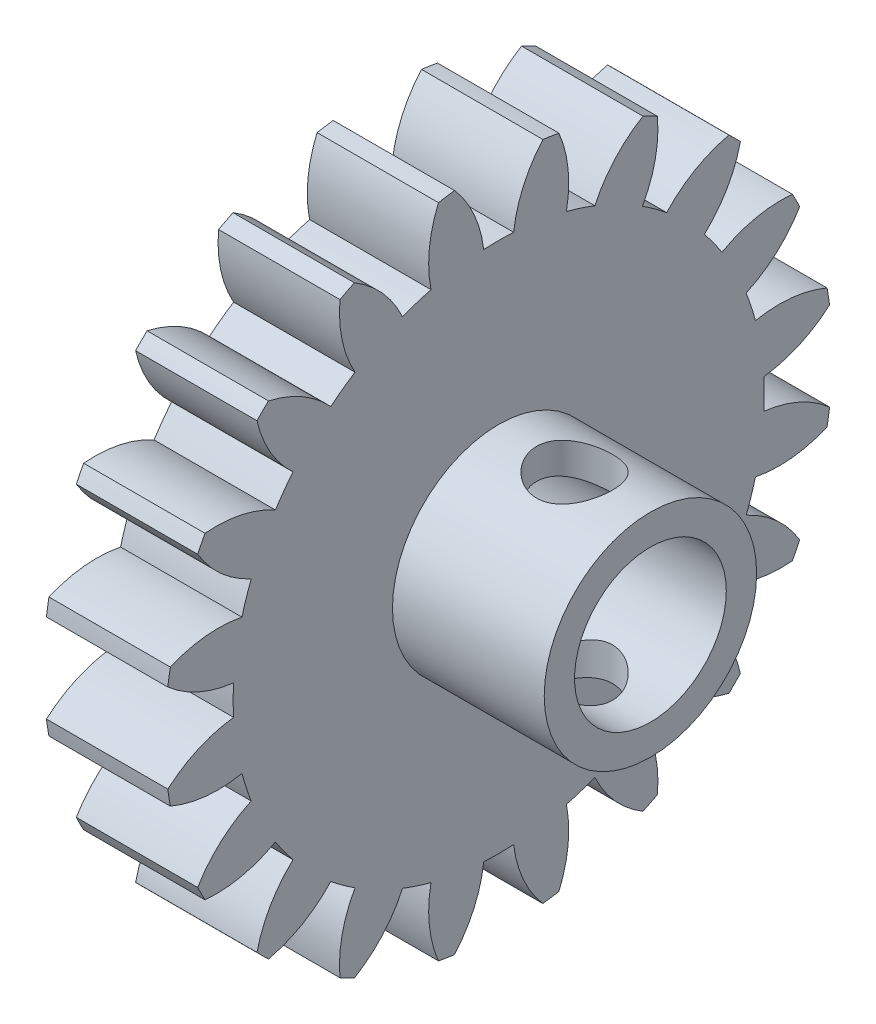
from build123d import *

# Parameters (mm, degrees)
BASPROSKE_W           = 8
BASPROSKE_H           = 22
TOOTHCUT_DEPTH        = 33.124756808
TEETHCUTS_COUNT       = 20
TEETHCUTS_ANGLE       = 342
BORSKE_R              = 5
BORE_DEPTH            = 50.0000508
BOSS_EXTRUDE1_START   = 10
SKETCH1_R             = 7
SKETCH1_R_2           = 5
BOSS_EXTRUDE1_DEPTH   = 10
F_5_0MM_DOWEL_HOLE1_D = 5


with BuildPart() as part:
    # BasProSke → Base-Revolve (revolve)
    with BuildSketch(Plane(origin=(0, 0, 0), x_dir=(1, 0, 0), z_dir=(0, 1, 0))):
        with Locations((4, 11)):
            Rectangle(BASPROSKE_W, BASPROSKE_H)
    revolve(axis=Axis((-10, 0, 0), (1, 0, 0)))

    # TooCutSke → ToothCut (cut, through all)
    with BuildSketch(Plane(origin=(0, 0, 0), x_dir=(0, 0, -1), z_dir=(1, 0, 0))):
        with BuildLine():
            ThreePointArc((0.986171591, 17.471189616), (0, 17.499), (-0.986171591, 17.471189616))
            ThreePointArc((-0.986171591, 17.471189616), (-1.626916196, 19.798789858), (-2.932850173, 21.829260982))
            ThreePointArc((-2.932850173, 21.829260982), (0, 22.0254), (2.932850173, 21.829260982))
            ThreePointArc((2.932850173, 21.829260982), (1.626916196, 19.798789858), (0.986171591, 17.471189616))
        make_face()
    toothcut = extrude(amount=TOOTHCUT_DEPTH, mode=Mode.SUBTRACT)

    # TeethCuts: ToothCut ×20 about axis
    teethcuts_axis = Axis((-10, 0, 0), (1, 0, 0))
    for i in range(1, TEETHCUTS_COUNT):
        add(toothcut.rotate(teethcuts_axis, i * TEETHCUTS_ANGLE / (TEETHCUTS_COUNT - 1)), mode=Mode.SUBTRACT)

    # BorSke → Bore (cut, symmetric)
    with BuildSketch(Plane(origin=(0, 0, 0), x_dir=(0, 0, -1), z_dir=(1, 0, 0))):
        Circle(BORSKE_R)
    extrude(amount=BORE_DEPTH, both=True, mode=Mode.SUBTRACT)

    # Sketch1 → Boss-Extrude1 (add)
    with BuildSketch(Plane(origin=(8, 0, 0), x_dir=(0, 0, -1), z_dir=(1, 0, 0)).offset(BOSS_EXTRUDE1_START)):
        Circle(SKETCH1_R)
        Circle(SKETCH1_R_2, mode=Mode.SUBTRACT)
    extrude(amount=-BOSS_EXTRUDE1_DEPTH)

    # Ø5.0mm Dowel Hole1 (through all)
    with Locations(Plane.XZ.offset(7)):
        with Locations((13, 0)):
            Hole(F_5_0MM_DOWEL_HOLE1_D / 2)


solid = part.part
